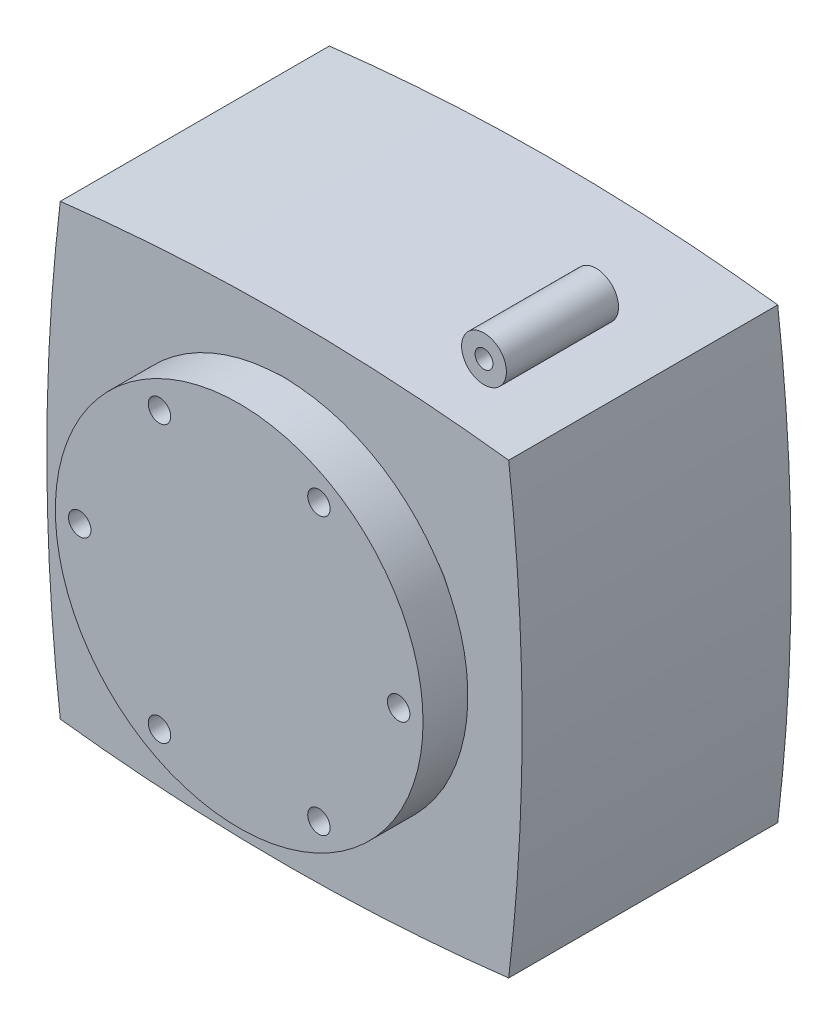
from build123d import *

# Parameters (mm, degrees)
SKETCH1_R           = 41
BOSS_EXTRUDE1_DEPTH = 10
SKETCH2_R           = 2.5
CUT_EXTRUDE1_DEPTH  = 10
BOSS_EXTRUDE3_DEPTH = 0.1
SKETCH4_W           = 100
SKETCH4_H           = 100
BOSS_EXTRUDE4_DEPTH = 10
SKETCH5_W           = 100
SKETCH5_H           = 100
SKETCH5_W_2         = 92
SKETCH5_H_2         = 92
BOSS_EXTRUDE5_DEPTH = 50
SKETCH7_W           = 92
SKETCH7_H           = 92
BOSS_EXTRUDE6_DEPTH = 60
SKETCH10_R          = 2.5
CUT_EXTRUDE3_DEPTH  = 103.625581778
SKETCH11_R          = 5
SKETCH11_R_2        = 2
BOSS_EXTRUDE7_DEPTH = 25


with BuildPart() as part:
    # Sketch1 → Boss-Extrude1 (new body)
    with BuildSketch(Plane.XY):
        Circle(SKETCH1_R)
    extrude(amount=BOSS_EXTRUDE1_DEPTH)

    # Sketch2 → Cut-Extrude1 (cut)
    with BuildSketch(Plane(origin=(0, 0, 0), x_dir=(-1, 0, 0), z_dir=(0, 0, -1))):
        with Locations((-35.56, 0)):
            Circle(SKETCH2_R)
        with Locations((35.56, 0)):
            Circle(SKETCH2_R)
        with Locations((-17.78, -30.795863359)):
            Circle(SKETCH2_R)
        with Locations((17.78, -30.795863359)):
            Circle(SKETCH2_R)
        with Locations((-17.78, 30.795863359)):
            Circle(SKETCH2_R)
        with Locations((17.78, 30.795863359)):
            Circle(SKETCH2_R)
    extrude(amount=-CUT_EXTRUDE1_DEPTH, mode=Mode.SUBTRACT)

    # Sketch3 → Boss-Extrude3 (add)
    with BuildSketch(Plane(origin=(0, 0, 0), x_dir=(-1, 0, 0), z_dir=(0, 0, -1))):
        with BuildLine():
            ThreePointArc((12.874570079, 33.147534528), (15.06, 26.084685162), (22.269321935, 27.723472015))
            ThreePointArc((22.269321935, 27.723472015), (35.507041555, 20.5), (35.143892013, 5.424062513))
            ThreePointArc((35.143892013, 5.424062513), (30.12, 0), (35.143892013, -5.424062513))
            ThreePointArc((35.143892013, -5.424062513), (35.507041555, -20.5), (22.269321935, -27.723472015))
            ThreePointArc((22.269321935, -27.723472015), (15.06, -26.084685162), (12.874570079, -33.147534528))
            ThreePointArc((12.874570079, -33.147534528), (0, -41), (-12.874570079, -33.147534528))
            ThreePointArc((-12.874570079, -33.147534528), (-15.06, -26.084685162), (-22.269321935, -27.723472015))
            ThreePointArc((-22.269321935, -27.723472015), (-35.507041555, -20.5), (-35.143892013, -5.424062513))
            ThreePointArc((-35.143892013, -5.424062513), (-30.12, 0), (-35.143892013, 5.424062513))
            ThreePointArc((-35.143892013, 5.424062513), (-35.507041555, 20.5), (-22.269321935, 27.723472015))
            ThreePointArc((-22.269321935, 27.723472015), (-15.06, 26.084685162), (-12.874570079, 33.147534528))
            ThreePointArc((-12.874570079, 33.147534528), (0, 41), (12.874570079, 33.147534528))
        make_face()
    extrude(amount=BOSS_EXTRUDE3_DEPTH)

    # Sketch4 → Boss-Extrude4 (add)
    with BuildSketch(Plane(origin=(0, 0, -0.1), x_dir=(-1, 0, 0), z_dir=(0, 0, -1))):
        Rectangle(SKETCH4_W, SKETCH4_H)
    extrude(amount=BOSS_EXTRUDE4_DEPTH)

    # Sketch5 → Boss-Extrude5 (add)
    with BuildSketch(Plane(origin=(0, 0, -10.1), x_dir=(-1, 0, 0), z_dir=(0, 0, -1))):
        Rectangle(SKETCH5_W, SKETCH5_H)
        Rectangle(SKETCH5_W_2, SKETCH5_H_2, mode=Mode.SUBTRACT)
    extrude(amount=BOSS_EXTRUDE5_DEPTH)

    # Sketch7 → Boss-Extrude6 (add)
    with BuildSketch(Plane(origin=(0, 0, -60.1), x_dir=(-1, 0, 0), z_dir=(0, 0, -1))):
        with BuildLine():
            add(Edge.make_bspline(
                [(-50, 50), (0, 56), (50, 50)],
                knots=[0, 0, 0, 1, 1, 1], degree=2))
            add(Edge.make_bspline(
                [(50, 50), (56, 0), (50, -50)],
                knots=[0, 0, 0, 1, 1, 1], degree=2))
            add(Edge.make_bspline(
                [(-50, -50), (0, -56), (50, -50)],
                knots=[0, 0, 0, 1, 1, 1], degree=2))
            add(Edge.make_bspline(
                [(-50, 50), (-56, 0), (-50, -50)],
                knots=[0, 0, 0, 1, 1, 1], degree=2))
        make_face()
        Rectangle(SKETCH7_W, SKETCH7_H, mode=Mode.SUBTRACT)
    extrude(amount=-BOSS_EXTRUDE6_DEPTH)

    # Sketch10 → Cut-Extrude3 (cut, through all)
    with BuildSketch(Plane.XY.offset(10)):
        with Locations(Location((-17.78, 30.795863359, 0), (0, 0, 180))):
            Circle(SKETCH10_R)
        with Locations(Location((17.78, 30.795863359, 0), (0, 0, 180))):
            Circle(SKETCH10_R)
        with Locations(Location((35.56, 0, 0), (0, 0, 180))):
            Circle(SKETCH10_R)
        with Locations(Location((17.78, -30.795863359, 0), (0, 0, 180))):
            Circle(SKETCH10_R)
        with Locations(Location((-17.78, -30.795863359, 0), (0, 0, 180))):
            Circle(SKETCH10_R)
        with Locations(Location((-35.56, 0, 0), (0, 0, 180))):
            Circle(SKETCH10_R)
    extrude(amount=-CUT_EXTRUDE3_DEPTH, mode=Mode.SUBTRACT)

    # Sketch11 → Boss-Extrude7 (add)
    # profile 1 of 4: a face of its own
    with BuildSketch(Plane(origin=(0, 0, -10.1), x_dir=(-1, 0, 0), z_dir=(0, 0, -1))):
        with Locations((-34.5, 1.257206107)):
            Circle(SKETCH11_R)
        with Locations(Location((-34.5, 1.257206107, 0), (0, 0, 143.823641493))):
            Circle(SKETCH11_R_2, mode=Mode.SUBTRACT)
    # profile 2 of 4: a face of its own
    with BuildSketch(Plane(origin=(0, 0, -10.1), x_dir=(-1, 0, 0), z_dir=(0, 0, -1))):
        with Locations((29, -17.602793893)):
            Circle(SKETCH11_R)
        with Locations((29, -17.602793893)):
            Circle(SKETCH11_R_2, mode=Mode.SUBTRACT)
    # profile 3 of 4: a face of its own
    with BuildSketch(Plane(origin=(0, 0, -10.1), x_dir=(-1, 0, 0), z_dir=(0, 0, -1))):
        with Locations((37.5, 43.817206107)):
            Circle(SKETCH11_R)
        with Locations((37.5, 43.817206107)):
            Circle(SKETCH11_R_2, mode=Mode.SUBTRACT)
    # profile 4 of 4: a face of its own
    with BuildSketch(Plane(origin=(0, 0, -10.1), x_dir=(-1, 0, 0), z_dir=(0, 0, -1))):
        with Locations((-34.5, 56.817206107)):
            Circle(SKETCH11_R)
        with Locations((-34.5, 56.817206107)):
            Circle(SKETCH11_R_2, mode=Mode.SUBTRACT)
    extrude(amount=BOSS_EXTRUDE7_DEPTH)


with BuildPart() as boss_extrude7_piece_1:
    # of the separate pieces the step leaves, piece 1, a body of its own (boss_extrude7_pieces)
    add(part.part.solids().sort_by_distance((46, -46, -60.1))[0])


with BuildPart() as boss_extrude7_piece_2:
    # of the separate pieces the step leaves, piece 2, a body of its own (boss_extrude7_pieces)
    add(part.part.solids().sort_by_distance((29.5, 56.817206107, -10.1))[0])


solid = Compound([boss_extrude7_piece_1.part, boss_extrude7_piece_2.part])
